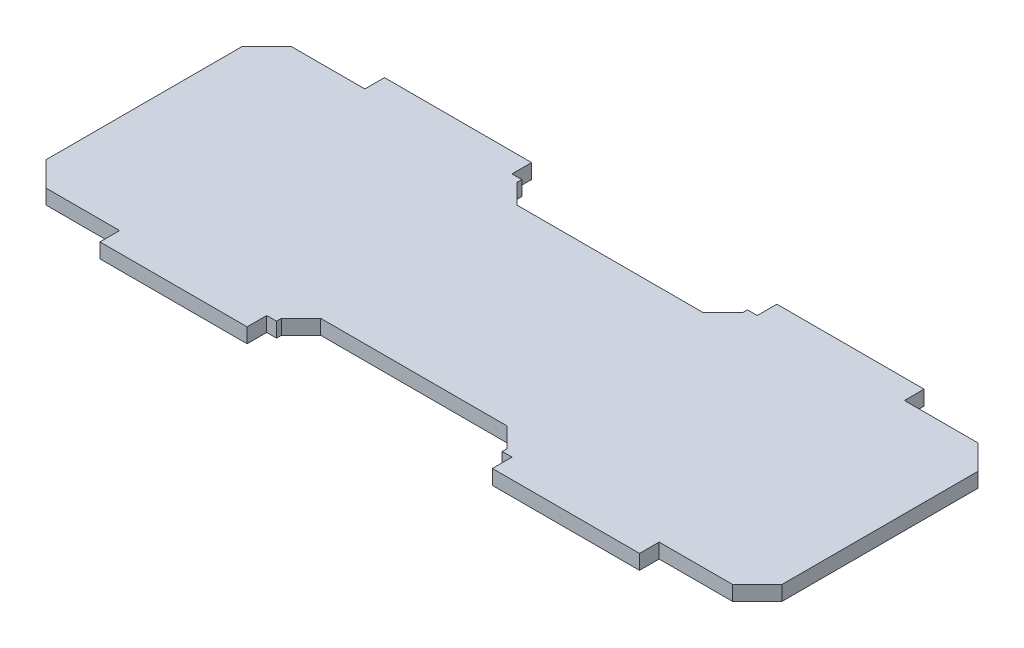
from build123d import *

# Parameters (mm, degrees)
SALIENTE_EXTRUIR1_DEPTH = 3


with BuildPart() as part:
    # Croquis1 → Saliente-Extruir1 (new body)
    with BuildSketch(Plane(origin=(0, 0, 0), x_dir=(1, 0, 0), z_dir=(0, 1, 0))):
        Polygon((-70, -25), (-55, -25), (-55, -29), (-25, -29), (-25, -25), (-23, -25), (-23, -24), (-19, -20), (19, -20), (23, -24), (23, -25), (25, -25), (25, -29), (55, -29), (55, -25), (70, -25), (75, -20), (75, 20), (70, 25), (55, 25), (55, 29), (25, 29), (25, 25), (23, 25), (23, 24), (19, 20), (-19, 20), (-23, 24), (-23, 25), (-25, 25), (-25, 29), (-55, 29), (-55, 25), (-70, 25), (-75, 20), (-75, -20), align=None)
    extrude(amount=SALIENTE_EXTRUIR1_DEPTH)


solid = part.part
